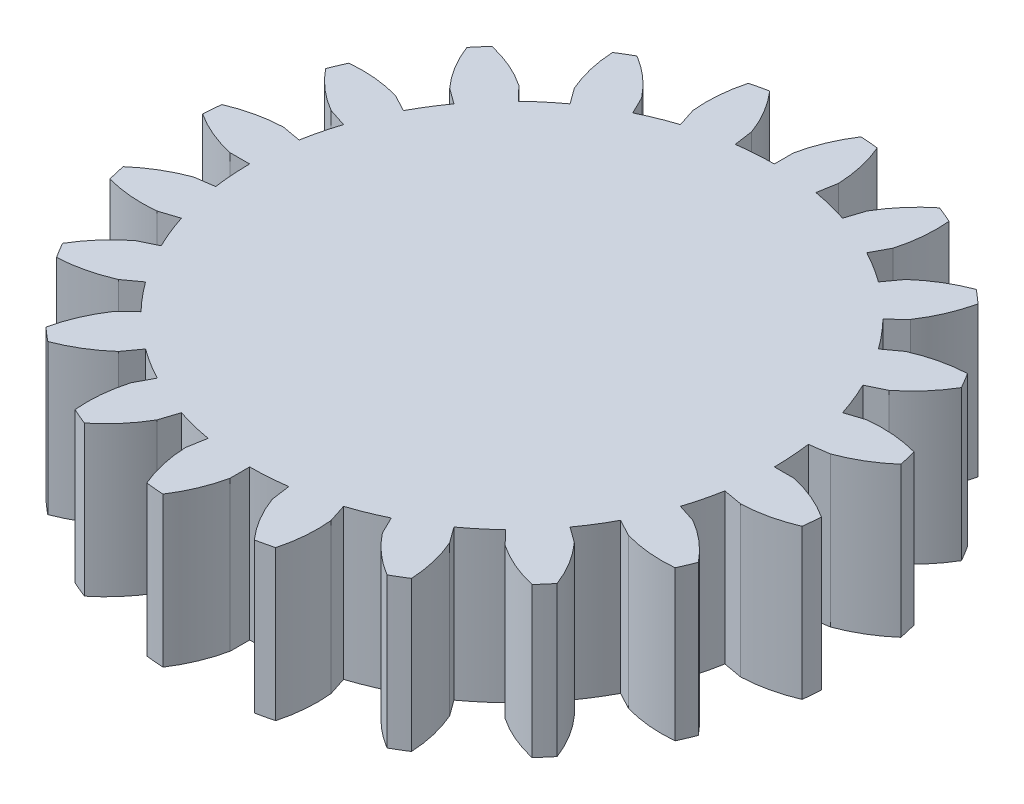
from build123d import *

# Parameters (mm, degrees)
BOSS_EXTRUDE1_DEPTH = 5
CIRPATTERN4_COUNT   = 20
SKETCH6_R           = 8.75
BOSS_EXTRUDE2_DEPTH = 5


with BuildPart() as part:
    # Sketch3 → Boss-Extrude1 (new body)
    with BuildSketch(Plane(origin=(0, 0, 0), x_dir=(1, 0, 0), z_dir=(0, 1, 0))):
        with BuildLine():
            Line((1.629672464, 9.254533474), (1.517478561, 8.617410215))
            ThreePointArc((1.517478561, 8.617410215), (0.761630034, 8.716789529), (0, 8.75))
            Line((0, 8.75), (0, 9.396926208))
            ThreePointArc((0, 9.396926208), (0.25763458, 10.219055101), (0.661482168, 10.980092957))
            ThreePointArc((0.661482168, 10.980092957), (0.957477757, 10.958249694), (1.252776281, 10.928428597))
            ThreePointArc((1.252776281, 10.928428597), (1.518520476, 10.108885116), (1.629672464, 9.254533474))
        make_face()
    extrude(amount=BOSS_EXTRUDE1_DEPTH)


with BuildPart() as cirpattern4_1:
    # CirPattern4: pattern copy
    add(part.part.rotate(Axis((0, 0, 0), (0, 1, 0)), 1 * 360 / CIRPATTERN4_COUNT))


with BuildPart() as cirpattern4_2:
    # CirPattern4: pattern copy
    add(part.part.rotate(Axis((0, 0, 0), (0, 1, 0)), 2 * 360 / CIRPATTERN4_COUNT))


with BuildPart() as cirpattern4_3:
    # CirPattern4: pattern copy
    add(part.part.rotate(Axis((0, 0, 0), (0, 1, 0)), 3 * 360 / CIRPATTERN4_COUNT))


with BuildPart() as cirpattern4_4:
    # CirPattern4: pattern copy
    add(part.part.rotate(Axis((0, 0, 0), (0, 1, 0)), 4 * 360 / CIRPATTERN4_COUNT))


with BuildPart() as cirpattern4_5:
    # CirPattern4: pattern copy
    add(part.part.rotate(Axis((0, 0, 0), (0, 1, 0)), 5 * 360 / CIRPATTERN4_COUNT))


with BuildPart() as cirpattern4_6:
    # CirPattern4: pattern copy
    add(part.part.rotate(Axis((0, 0, 0), (0, 1, 0)), 6 * 360 / CIRPATTERN4_COUNT))


with BuildPart() as cirpattern4_7:
    # CirPattern4: pattern copy
    add(part.part.rotate(Axis((0, 0, 0), (0, 1, 0)), 7 * 360 / CIRPATTERN4_COUNT))


with BuildPart() as cirpattern4_8:
    # CirPattern4: pattern copy
    add(part.part.rotate(Axis((0, 0, 0), (0, 1, 0)), 8 * 360 / CIRPATTERN4_COUNT))


with BuildPart() as cirpattern4_9:
    # CirPattern4: pattern copy
    add(part.part.rotate(Axis((0, 0, 0), (0, 1, 0)), 9 * 360 / CIRPATTERN4_COUNT))


with BuildPart() as cirpattern4_10:
    # CirPattern4: pattern copy
    add(part.part.rotate(Axis((0, 0, 0), (0, 1, 0)), 10 * 360 / CIRPATTERN4_COUNT))


with BuildPart() as cirpattern4_11:
    # CirPattern4: pattern copy
    add(part.part.rotate(Axis((0, 0, 0), (0, 1, 0)), 11 * 360 / CIRPATTERN4_COUNT))


with BuildPart() as cirpattern4_12:
    # CirPattern4: pattern copy
    add(part.part.rotate(Axis((0, 0, 0), (0, 1, 0)), 12 * 360 / CIRPATTERN4_COUNT))


with BuildPart() as cirpattern4_13:
    # CirPattern4: pattern copy
    add(part.part.rotate(Axis((0, 0, 0), (0, 1, 0)), 13 * 360 / CIRPATTERN4_COUNT))


with BuildPart() as cirpattern4_14:
    # CirPattern4: pattern copy
    add(part.part.rotate(Axis((0, 0, 0), (0, 1, 0)), 14 * 360 / CIRPATTERN4_COUNT))


with BuildPart() as cirpattern4_15:
    # CirPattern4: pattern copy
    add(part.part.rotate(Axis((0, 0, 0), (0, 1, 0)), 15 * 360 / CIRPATTERN4_COUNT))


with BuildPart() as cirpattern4_16:
    # CirPattern4: pattern copy
    add(part.part.rotate(Axis((0, 0, 0), (0, 1, 0)), 16 * 360 / CIRPATTERN4_COUNT))


with BuildPart() as cirpattern4_17:
    # CirPattern4: pattern copy
    add(part.part.rotate(Axis((0, 0, 0), (0, 1, 0)), 17 * 360 / CIRPATTERN4_COUNT))


with BuildPart() as cirpattern4_18:
    # CirPattern4: pattern copy
    add(part.part.rotate(Axis((0, 0, 0), (0, 1, 0)), 18 * 360 / CIRPATTERN4_COUNT))


with BuildPart() as cirpattern4_19:
    # CirPattern4: pattern copy
    add(part.part.rotate(Axis((0, 0, 0), (0, 1, 0)), 19 * 360 / CIRPATTERN4_COUNT))


with BuildPart() as part_1:
    add(part.part)

    add(cirpattern4_1.part)  # Boss-Extrude2 merges CirPattern4_1

    add(cirpattern4_2.part)  # Boss-Extrude2 merges CirPattern4_2

    add(cirpattern4_3.part)  # Boss-Extrude2 merges CirPattern4_3

    add(cirpattern4_4.part)  # Boss-Extrude2 merges CirPattern4_4

    add(cirpattern4_5.part)  # Boss-Extrude2 merges CirPattern4_5

    add(cirpattern4_6.part)  # Boss-Extrude2 merges CirPattern4_6

    add(cirpattern4_7.part)  # Boss-Extrude2 merges CirPattern4_7

    add(cirpattern4_8.part)  # Boss-Extrude2 merges CirPattern4_8

    add(cirpattern4_9.part)  # Boss-Extrude2 merges CirPattern4_9

    add(cirpattern4_10.part)  # Boss-Extrude2 merges CirPattern4_10

    add(cirpattern4_11.part)  # Boss-Extrude2 merges CirPattern4_11

    add(cirpattern4_12.part)  # Boss-Extrude2 merges CirPattern4_12

    add(cirpattern4_13.part)  # Boss-Extrude2 merges CirPattern4_13

    add(cirpattern4_14.part)  # Boss-Extrude2 merges CirPattern4_14

    add(cirpattern4_15.part)  # Boss-Extrude2 merges CirPattern4_15

    add(cirpattern4_16.part)  # Boss-Extrude2 merges CirPattern4_16

    add(cirpattern4_17.part)  # Boss-Extrude2 merges CirPattern4_17

    add(cirpattern4_18.part)  # Boss-Extrude2 merges CirPattern4_18

    add(cirpattern4_19.part)  # Boss-Extrude2 merges CirPattern4_19
    # Sketch6 → Boss-Extrude2 (add)
    with BuildSketch(Plane(origin=(0, 0, 0), x_dir=(1, 0, 0), z_dir=(0, 1, 0))):
        Circle(SKETCH6_R)
    extrude(amount=BOSS_EXTRUDE2_DEPTH)


solid = part_1.part
